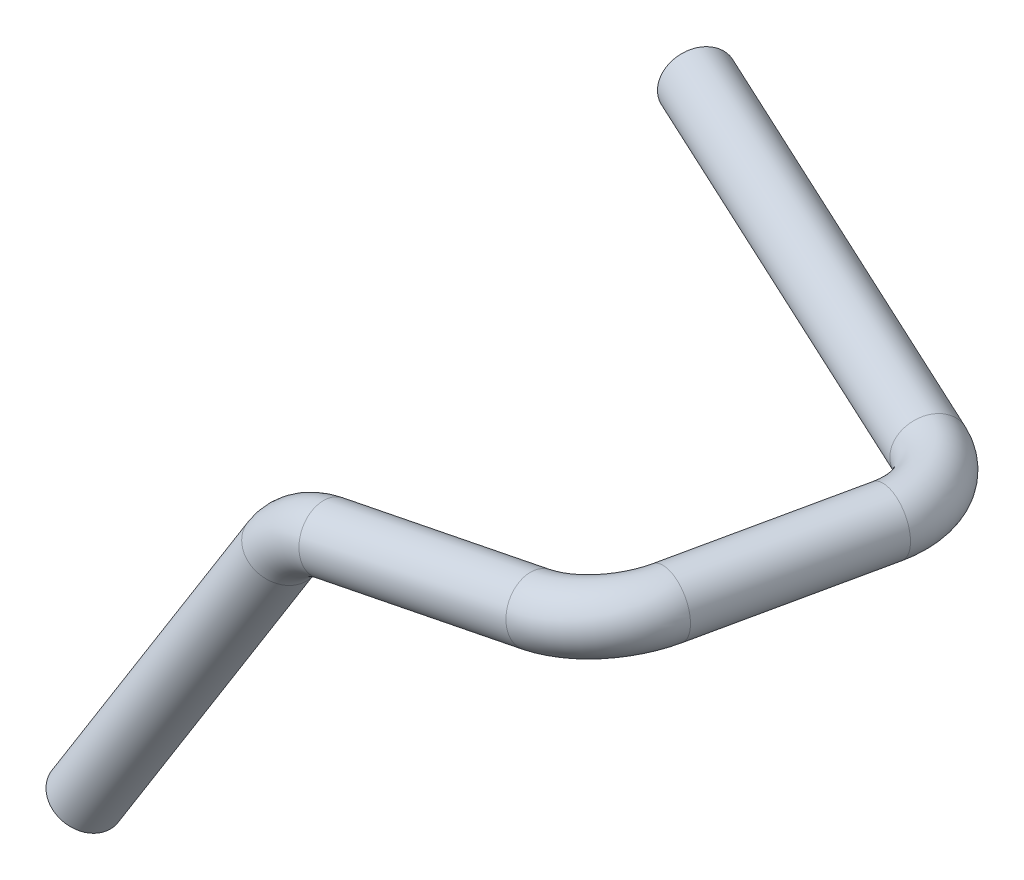
from build123d import *

# Parameters (mm, degrees)
SWEEP_1_PROFILE_R   = 12
SWEEP_1_PROFILE_R_2 = 10


with BuildPart() as part:
    # 扫描-薄件1: sweep along a curve in space
    with BuildLine() as sweep_1_path:
        Line((-293.907053201, -176.904078828, 0), (-215.210942182, -51.240174508, 0))
        ThreePointArc((-215.210942182, -51.240174508, 0), (-206.832168677, -42.47680964, 0), (-195.669049964, -37.745510677, 0))
        Line((-195.669049964, -37.745510677, 0), (-112.434772166, -21.097592117, 0))
        ThreePointArc((-83.45170927, -16.323468261, -23.798598546), (-93.844250534, -17.667130883, -6.69804309), (-112.434772166, -21.097592117, 0))
        Line((-83.45170927, -16.323468261, -23.798598546), (-67.801697088, -16.323468261, -96.628223589))
        ThreePointArc((-67.801697088, -16.323468261, -96.628223589), (-70.278739917, -16.323468261, -116.306023698), (-84.49226654, -16.323468261, -130.138131969))
        Line((-84.49226654, -16.323468261, -130.138131969), (-258.992373197, -16.323468261, -211.207155939))
    # 扫描-薄件1 profile (on start of the path) → 扫描-薄件1 (sweep)
    with BuildSketch(Plane(origin=(-293.907053201, -176.904078828, 0), x_dir=(0.8475245838768447, -0.5307561396012122, 0), z_dir=(0.5307561396012122, 0.8475245838768447, 0))):
        Circle(SWEEP_1_PROFILE_R)
        Circle(SWEEP_1_PROFILE_R_2, mode=Mode.SUBTRACT)
    sweep(path=sweep_1_path.line)


solid = part.part
